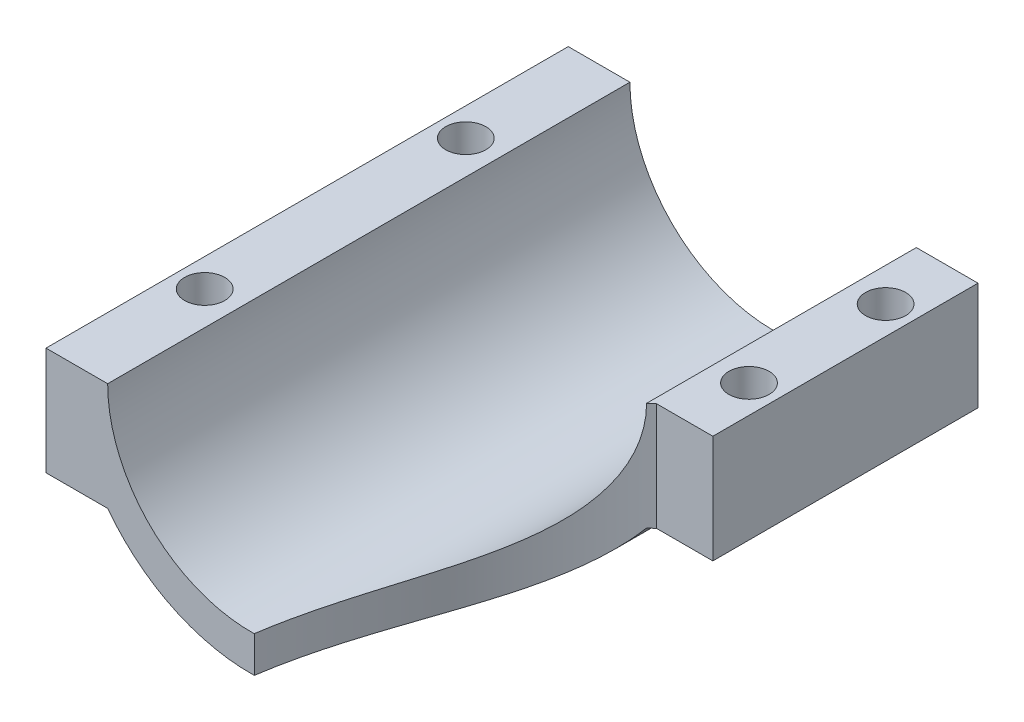
from build123d import *

# Parameters (mm, degrees)
SKETCH1_W           = 7
SKETCH1_H           = 65
SKETCH1_R           = 2.5
SKETCH1_H_2         = 33
BOSS_EXTRUDE1_DEPTH = 22.325
SKETCH2_R           = 17.825
CUT_EXTRUDE1_DEPTH  = 74.305222358
SKETCH3_R           = 6
CUT_EXTRUDE2_DEPTH  = 22.325


with BuildPart() as part:
    # Sketch1 → Boss-Extrude1 (new body)
    # profile 1 of 3: a face of its own
    with BuildSketch(Plane(origin=(0, 0, 0), x_dir=(1, 0, 0), z_dir=(0, 1, 0))):
        with Locations((22, 0)):
            Rectangle(SKETCH1_W, SKETCH1_H)
        with Locations(Location((22, -16.25, 0), (0, 0, 90))):
            Circle(SKETCH1_R, mode=Mode.SUBTRACT)
        with Locations(Location((22, 16.25, 0), (0, 0, 90))):
            Circle(SKETCH1_R, mode=Mode.SUBTRACT)
    # profile 2 of 3: a face of its own
    with BuildSketch(Plane(origin=(0, 0, 0), x_dir=(1, 0, 0), z_dir=(0, 1, 0))):
        with BuildLine():
            Line((-18.5, 32.5), (-18.5, -0.5))
            ThreePointArc((-18.5, -0.5), (-6.523379041, -14.840809158), (-0.42, -32.5))
            Line((-0.42, -32.5), (18.5, -32.5))
            Line((18.5, -32.5), (18.5, 32.5))
            Line((18.5, 32.5), (-18.5, 32.5))
        make_face()
    # profile 3 of 3: a face of its own
    with BuildSketch(Plane(origin=(0, 0, 0), x_dir=(1, 0, 0), z_dir=(0, 1, 0))):
        with Locations((-22, 16)):
            Rectangle(SKETCH1_W, SKETCH1_H_2)
        with Locations(Location((-22, 7.5, 0), (0, 0, 90))):
            Circle(SKETCH1_R, mode=Mode.SUBTRACT)
        with Locations(Location((-22, 24.5, 0), (0, 0, 90))):
            Circle(SKETCH1_R, mode=Mode.SUBTRACT)
    extrude(amount=BOSS_EXTRUDE1_DEPTH)

    # Sketch2 → Cut-Extrude1 (cut, through all)
    with BuildSketch(Plane(origin=(0, 0, -32.5), x_dir=(-1, 0, 0), z_dir=(0, 0, -1))):
        with Locations((0, 22.325)):
            Circle(SKETCH2_R)
        with BuildLine():
            Line((-17.825, 8.88345991), (-25.5, 8.88345991))
            Line((-25.5, 8.88345991), (-25.5, -2.88343075))
            Line((-25.5, -2.88343075), (25.5, -2.88343075))
            Line((25.5, -2.88343075), (25.5, 8.88345991))
            Line((25.5, 8.88345991), (17.825, 8.88345991))
            ThreePointArc((17.825, 8.88345991), (0, 0), (-17.825, 8.88345991))
        make_face()
    extrude(amount=-CUT_EXTRUDE1_DEPTH, mode=Mode.SUBTRACT)

    # Sketch3 → Cut-Extrude2 (cut)
    with BuildSketch(Plane.XZ.offset(-8.88345991)):
        with Locations((-22, -7.5)):
            Circle(SKETCH3_R)
        with Locations((22, -16.25)):
            Circle(SKETCH3_R)
        with Locations((22, 16.25)):
            Circle(SKETCH3_R)
        with Locations((-22, -24.5)):
            Circle(SKETCH3_R)
    extrude(amount=CUT_EXTRUDE2_DEPTH, mode=Mode.SUBTRACT)


with BuildPart() as body_2:
    # Mirror2: mirrored copy
    add(part.part.mirror(Plane(origin=(-25.5, 22.325, 0), x_dir=(0, 0, 1), z_dir=(-1, 0, 0))))


solid = body_2.part
